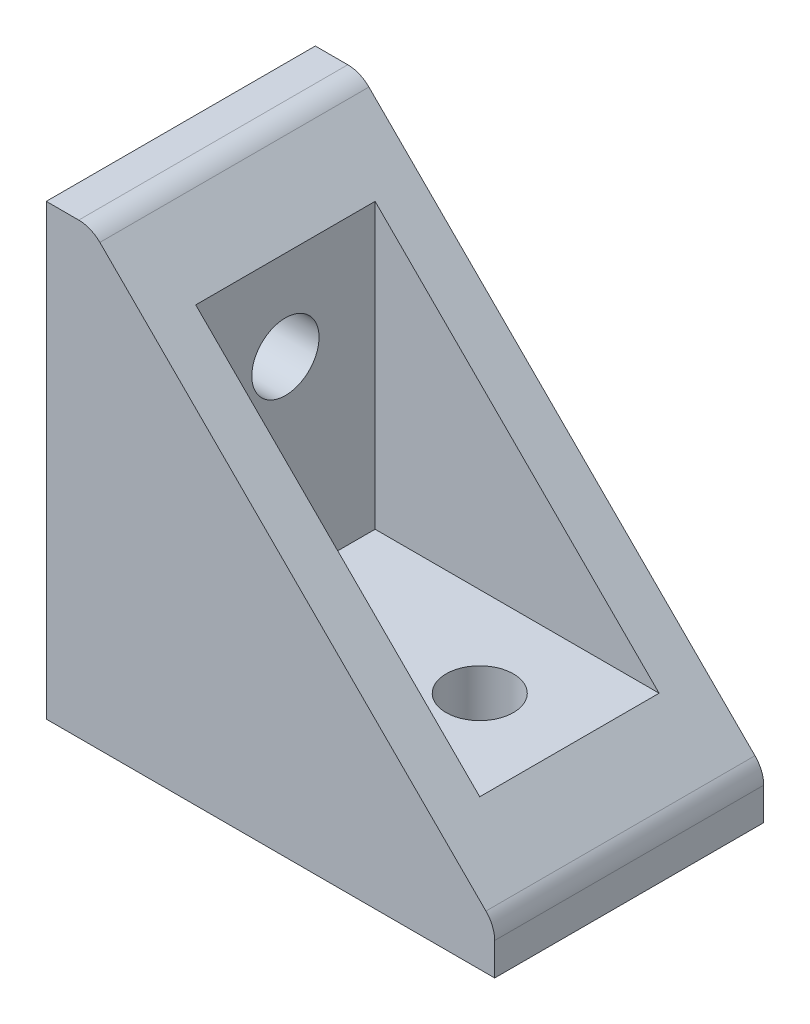
from build123d import *

# Parameters (mm, degrees)
EXTRUDE_1_DEPTH      = 9
EXTRUDE_1_DEPTH_BACK = 9
SKETCH_6_R           = 2.25
CUT_EXTRUDE_1_DEPTH  = 44.370496884
SKETCH_7_W           = 20
SKETCH_7_H           = 12
CUT_EXTRUDE_2_DEPTH  = 23
SKETCH_8_W           = 6
SKETCH_8_H           = 14
EXTRUDE_2_DEPTH      = 3
FILLET_1_R           = 2


with BuildPart() as part:
    # Эскиз3 → Бобышка-Вытянуть1 (new, two sides: drawn at the far end of the back side and taken through both)
    with BuildSketch(Plane.XY.offset(-EXTRUDE_1_DEPTH_BACK)):
        Polygon((0, 0), (30, 0), (30, 3), (3, 30), (0, 30), align=None)
    extrude(amount=EXTRUDE_1_DEPTH + EXTRUDE_1_DEPTH_BACK)

    # Эскиз6 → Вырез-Вытянуть1 (cut, through all)
    with BuildSketch(Plane.ZY):
        with Locations((0, 20)):
            Circle(SKETCH_6_R)
    cut_extrude_1 = extrude(amount=-CUT_EXTRUDE_1_DEPTH, mode=Mode.SUBTRACT)

    # Эскиз7 → Вырез-Вытянуть2 (cut)
    with BuildSketch(Plane(origin=(0, 30, 0), x_dir=(1, 0, 0), z_dir=(0, 1, 0))):
        with Locations((17, 0)):
            Rectangle(SKETCH_7_W, SKETCH_7_H)
    extrude(amount=-CUT_EXTRUDE_2_DEPTH, mode=Mode.SUBTRACT)

    # Эскиз8 → Бобышка-Вытянуть2 (add)
    with BuildSketch(Plane.ZY):
        with Locations((0, 7)):
            Rectangle(SKETCH_8_W, SKETCH_8_H)
    extrude_2 = extrude(amount=EXTRUDE_2_DEPTH)

    # Зеркальное отражение1: Вырез-Вытянуть1, Бобышка-Вытянуть2 across plane
    add(cut_extrude_1.mirror(Plane(origin=(0, 0, 0), x_dir=(0, 0, 1), z_dir=(0.7071067811865476, -0.7071067811865475, 0))), mode=Mode.SUBTRACT)
    add(extrude_2.mirror(Plane(origin=(0, 0, 0), x_dir=(0, 0, 1), z_dir=(0.7071067811865476, -0.7071067811865475, 0))))

    # Скругление1
    fillet_1_edges = [part.edges().sort_by_distance(p)[0] for p in [
        (30, 3, 0),
        (3, 30, 0),
    ]]
    fillet(fillet_1_edges, radius=FILLET_1_R)


solid = part.part
